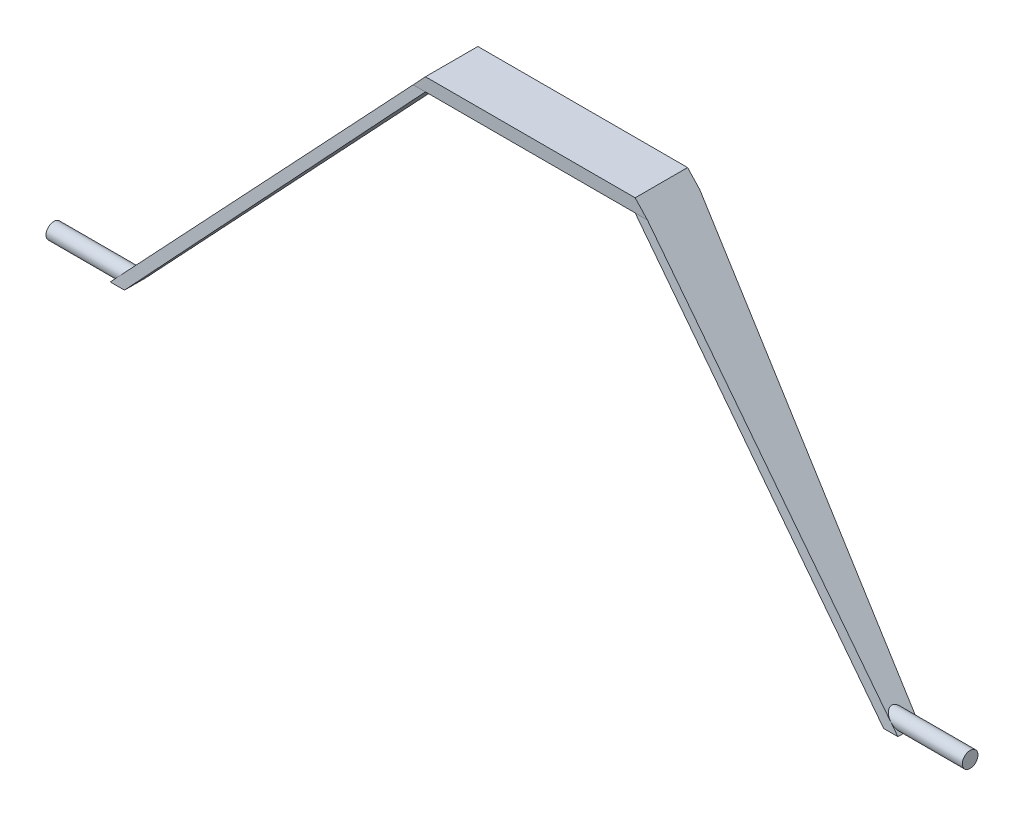
from build123d import *

# Parameters (mm, degrees)
BOSS_EXTRUDE6_DEPTH              = 53.34
BOSS_EXTRUDE6_DEPTH_BACK         = 101.6
CUT_EXTRUDE8_REACH               = 902.262
CUT_EXTRUDE8_DIRECTION_2_REACH   = 902.262
SKETCH15_R                       = 19.05
BOSS_EXTRUDE8_DEPTH              = 127
CUT_EXTRUDE9_REACH               = 1709.816
SKETCH16_W                       = 38.1
SKETCH16_H                       = 10.414
CUT_EXTRUDE9_DIRECTION_2_REACH   = 1709.816
SKETCH17_R                       = 15.24
BOSS_EXTRUDE9_DEPTH              = 127
BOSS_EXTRUDE9_DIRECTION_2_REACH  = 1707.258
SKETCH18_R                       = 15.24
BOSS_EXTRUDE10_DEPTH             = 127
BOSS_EXTRUDE10_DIRECTION_2_REACH = 1704.799
CUT_EXTRUDE10_REACH              = 1704.799
CUT_EXTRUDE10_DIRECTION_2_REACH  = 1704.799


with BuildPart() as part:
    # Sketch12 → Boss-Extrude6 (new, two sides: drawn at the far end of the back side and taken through both)
    with BuildSketch(Plane.XY.offset(-BOSS_EXTRUDE6_DEPTH_BACK)):
        Polygon((-203.2, 241.3), (203.2, 241.3), (787.471663752, -383.669201703), (787.471663752, -424.309201703), (762.071663752, -424.309201703), (762.071663752, -386.209201703), (203.2, 215.9), (-203.2, 215.9), (-762.071663752, -386.209201703), (-762.071663752, -424.309201703), (-787.471663752, -424.309201703), (-787.471663752, -383.669201703), align=None)
    extrude(amount=BOSS_EXTRUDE6_DEPTH + BOSS_EXTRUDE6_DEPTH_BACK)

    # Cut-Extrude8: up to this plane
    cut_extrude8_end = Plane(origin=(-203.2, 241.3, -101.6), z_dir=(-0.7304911811601322, 0.6829221289775833, 0))
    # Sketch14 → Cut-Extrude8 (cut, up to the surface)
    with BuildSketch(Plane(origin=(0, 0, 0), x_dir=(0, 0, -1), z_dir=(1, 0, 0)), mode=Mode.PRIVATE) as cut_extrude8_sk1:
        Polygon((0, 241.3), (0, 215.9), (-53.34, -386.209201703), (-53.34, 241.3), align=None)
    cut_extrude8_tool1 = split(extrude(cut_extrude8_sk1.sketch, amount=-CUT_EXTRUDE8_REACH, mode=Mode.PRIVATE), bisect_by=cut_extrude8_end, keep=Keep.BOTH, mode=Mode.PRIVATE)
    add(cut_extrude8_tool1.solids().sort_by_distance((0, 31.800889, 34.868308))[0], mode=Mode.SUBTRACT)
    # Sketch14 → Cut-Extrude8 (cut, up to the surface)
    with BuildSketch(Plane(origin=(0, 0, 0), x_dir=(0, 0, -1), z_dir=(1, 0, 0)), mode=Mode.PRIVATE) as cut_extrude8_sk2:
        Polygon((101.6, 215.9), (-15.24, -386.209201703), (-15.24, -424.309201703), (101.6, -424.309201703), align=None)
    cut_extrude8_tool2 = split(extrude(cut_extrude8_sk2.sketch, amount=-CUT_EXTRUDE8_REACH, mode=Mode.PRIVATE), bisect_by=cut_extrude8_end, keep=Keep.BOTH, mode=Mode.PRIVATE)
    add(cut_extrude8_tool2.solids().sort_by_distance((0, -210.192787, -60.465735))[0], mode=Mode.SUBTRACT)

    # Cut-Extrude8 direction 2: up to this plane
    cut_extrude8_direction_2_end = Plane(origin=(203.2, 241.3, -101.6), z_dir=(0.7304911811601321, 0.6829221289775835, 0))
    # Sketch14 → Cut-Extrude8 direction 2 (cut, up to the surface)
    with BuildSketch(Plane(origin=(0, 0, 0), x_dir=(0, 0, -1), z_dir=(1, 0, 0)), mode=Mode.PRIVATE) as cut_extrude8_direction_2_sk1:
        Polygon((0, 241.3), (0, 215.9), (-53.34, -386.209201703), (-53.34, 241.3), align=None)
    cut_extrude8_direction_2_tool1 = split(extrude(cut_extrude8_direction_2_sk1.sketch, amount=CUT_EXTRUDE8_DIRECTION_2_REACH, mode=Mode.PRIVATE), bisect_by=cut_extrude8_direction_2_end, keep=Keep.BOTH, mode=Mode.PRIVATE)
    add(cut_extrude8_direction_2_tool1.solids().sort_by_distance((0, 31.800889, 34.868308))[0], mode=Mode.SUBTRACT)
    # Sketch14 → Cut-Extrude8 direction 2 (cut, up to the surface)
    with BuildSketch(Plane(origin=(0, 0, 0), x_dir=(0, 0, -1), z_dir=(1, 0, 0)), mode=Mode.PRIVATE) as cut_extrude8_direction_2_sk2:
        Polygon((101.6, 215.9), (-15.24, -386.209201703), (-15.24, -424.309201703), (101.6, -424.309201703), align=None)
    cut_extrude8_direction_2_tool2 = split(extrude(cut_extrude8_direction_2_sk2.sketch, amount=CUT_EXTRUDE8_DIRECTION_2_REACH, mode=Mode.PRIVATE), bisect_by=cut_extrude8_direction_2_end, keep=Keep.BOTH, mode=Mode.PRIVATE)
    add(cut_extrude8_direction_2_tool2.solids().sort_by_distance((0, -210.192787, -60.465735))[0], mode=Mode.SUBTRACT)

    # Sketch15 → Boss-Extrude8 (add)
    with BuildSketch(Plane.ZY.offset(762.071663752)):
        with Locations((34.29, -394.845201703)):
            Circle(SKETCH15_R)
    boss_extrude8 = extrude(amount=BOSS_EXTRUDE8_DEPTH)

    # Mirror2: Boss-Extrude8 across plane
    add(boss_extrude8.mirror(Plane(origin=(0, 0, 0), x_dir=(0, 0, 1), z_dir=(1, 0, 0))))

    # Cut-Extrude9: up to this face of the body (flat: up to its plane)
    cut_extrude9_end = Plane(part.part.faces().sort_by_distance((-787.471663752, -416.434815963, 34.29))[0])
    # Sketch16 → Cut-Extrude9 (cut, up to the picked face)
    with BuildSketch(Plane.ZY.offset(762.071663752), mode=Mode.PRIVATE) as cut_extrude9_sk1:
        with Locations((34.29, -419.102201703)):
            Rectangle(SKETCH16_W, SKETCH16_H)
    cut_extrude9_tool1 = split(extrude(cut_extrude9_sk1.sketch, amount=CUT_EXTRUDE9_REACH, mode=Mode.PRIVATE), bisect_by=cut_extrude9_end, keep=Keep.BOTH, mode=Mode.PRIVATE)
    add(cut_extrude9_tool1.solids().sort_by(Axis((-762.071664, -419.102202, 34.29), (-1, 0, 0)))[0], mode=Mode.SUBTRACT)

    # Cut-Extrude9 direction 2: up to this face of the body (flat: up to its plane)
    cut_extrude9_direction_2_end = Plane(part.part.faces().sort_by_distance((787.471663752, -416.434815963, 34.29))[0])
    # Sketch16 → Cut-Extrude9 direction 2 (cut, up to the picked face)
    with BuildSketch(Plane.ZY.offset(762.071663752), mode=Mode.PRIVATE) as cut_extrude9_direction_2_sk1:
        with Locations((34.29, -419.102201703)):
            Rectangle(SKETCH16_W, SKETCH16_H)
    cut_extrude9_direction_2_tool1 = split(extrude(cut_extrude9_direction_2_sk1.sketch, amount=-CUT_EXTRUDE9_DIRECTION_2_REACH, mode=Mode.PRIVATE), bisect_by=cut_extrude9_direction_2_end, keep=Keep.BOTH, mode=Mode.PRIVATE)
    add(cut_extrude9_direction_2_tool1.solids().sort_by(Axis((-762.071664, -419.102202, 34.29), (1, 0, 0)))[0], mode=Mode.SUBTRACT)

    # Sketch17 → Boss-Extrude9 (add)
    with BuildSketch(Plane.ZY.offset(762.071663752)):
        with Locations((34.29, -342.521201703)):
            Circle(SKETCH17_R)
    extrude(amount=BOSS_EXTRUDE9_DEPTH)

    # Boss-Extrude9 direction 2: up to this face of the body (flat: up to its plane)
    boss_extrude9_direction_2_end = Plane(part.part.faces().sort_by_distance((-449.243763763, -21.881982223, -17.095411005))[0])
    # Sketch17 → Boss-Extrude9 direction 2 (add, up to the picked face)
    with BuildSketch(Plane.ZY.offset(762.071663752), mode=Mode.PRIVATE) as boss_extrude9_direction_2_sk1:
        with Locations((34.29, -342.521201703)):
            Circle(SKETCH17_R)
    boss_extrude9_direction_2_tool1 = split(extrude(boss_extrude9_direction_2_sk1.sketch, amount=-BOSS_EXTRUDE9_DIRECTION_2_REACH, mode=Mode.PRIVATE), bisect_by=boss_extrude9_direction_2_end, keep=Keep.BOTH, mode=Mode.PRIVATE)
    add(boss_extrude9_direction_2_tool1.solids().sort_by(Axis((-762.071664, -342.521202, 34.29), (1, 0, 0)))[0])

    # Sketch18 → Boss-Extrude10 (add)
    with BuildSketch(Plane.ZY.offset(-759.531663752)):
        with Locations(Location((34.117724321, -342.561697921, 0), (0, 0, 270))):
            Circle(SKETCH18_R)
    extrude(amount=-BOSS_EXTRUDE10_DEPTH)

    # Boss-Extrude10 direction 2: up to this face of the body (flat: up to its plane)
    boss_extrude10_direction_2_end = Plane(part.part.faces().sort_by_distance((449.243763763, -21.881982223, -17.095411005))[0])
    # Sketch18 → Boss-Extrude10 direction 2 (add, up to the picked face)
    with BuildSketch(Plane.ZY.offset(-759.531663752), mode=Mode.PRIVATE) as boss_extrude10_direction_2_sk1:
        with Locations(Location((34.117724321, -342.561697921, 0), (0, 0, 270))):
            Circle(SKETCH18_R)
    boss_extrude10_direction_2_tool1 = split(extrude(boss_extrude10_direction_2_sk1.sketch, amount=BOSS_EXTRUDE10_DIRECTION_2_REACH, mode=Mode.PRIVATE), bisect_by=boss_extrude10_direction_2_end, keep=Keep.BOTH, mode=Mode.PRIVATE)
    add(boss_extrude10_direction_2_tool1.solids().sort_by(Axis((759.531664, -342.561698, 34.117724), (-1, 0, 0)))[0])

    # Cut-Extrude10: up to this face of the body (flat: up to its plane)
    cut_extrude10_end = Plane(part.part.faces().sort_by_distance((889.071663752, -394.845201703, 34.29))[0])
    # Sketch19 → Cut-Extrude10 (cut, up to the picked face)
    with BuildSketch(Plane.ZY.offset(-759.531663752), mode=Mode.PRIVATE) as cut_extrude10_sk1:
        Polygon((53.34, -413.895201703), (53.34, -360.809201703), (53.34, -357.761201703), (9.719632082, -357.761201703), (9.719632082, -413.895201703), (10.311100074, -413.895201703), align=None)
    cut_extrude10_tool1 = split(extrude(cut_extrude10_sk1.sketch, amount=-CUT_EXTRUDE10_REACH, mode=Mode.PRIVATE), bisect_by=cut_extrude10_end, keep=Keep.BOTH, mode=Mode.PRIVATE)
    add(cut_extrude10_tool1.solids().sort_by(Axis((759.531664, -385.828202, 31.529816), (1, 0, 0)))[0], mode=Mode.SUBTRACT)

    # Cut-Extrude10 direction 2: up to this face of the body (flat: up to its plane)
    cut_extrude10_direction_2_end = Plane(part.part.faces().sort_by_distance((-889.071663752, -394.845201703, 34.29))[0])
    # Sketch19 → Cut-Extrude10 direction 2 (cut, up to the picked face)
    with BuildSketch(Plane.ZY.offset(-759.531663752), mode=Mode.PRIVATE) as cut_extrude10_direction_2_sk1:
        Polygon((53.34, -413.895201703), (53.34, -360.809201703), (53.34, -357.761201703), (9.719632082, -357.761201703), (9.719632082, -413.895201703), (10.311100074, -413.895201703), align=None)
    cut_extrude10_direction_2_tool1 = split(extrude(cut_extrude10_direction_2_sk1.sketch, amount=CUT_EXTRUDE10_DIRECTION_2_REACH, mode=Mode.PRIVATE), bisect_by=cut_extrude10_direction_2_end, keep=Keep.BOTH, mode=Mode.PRIVATE)
    add(cut_extrude10_direction_2_tool1.solids().sort_by(Axis((759.531664, -385.828202, 31.529816), (-1, 0, 0)))[0], mode=Mode.SUBTRACT)


solid = part.part
